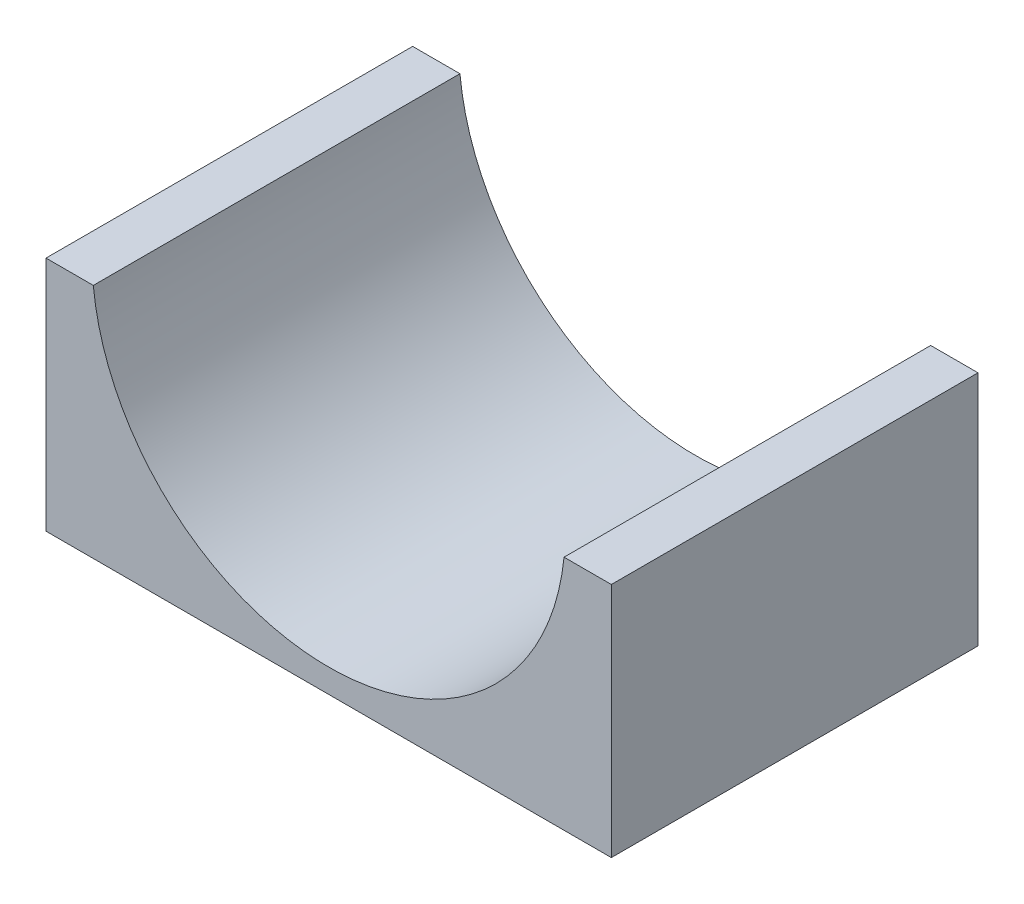
from build123d import *

# Parameters (mm, degrees)
EXTRUDE_1_DEPTH = 15.5


with BuildPart() as part:
    # 草图1 → 凸台-拉伸1 (new body)
    with BuildSketch(Plane.XY):
        with BuildLine():
            Line((10.713527709, 1.733694434), (12.713527709, 1.733694434))
            Line((12.713527709, 1.733694434), (12.713527709, -8.266305566))
            Line((12.713527709, -8.266305566), (-11.186221033, -8.266305566))
            Line((-11.186221033, -8.266305566), (-11.186221033, 1.733694434))
            Line((-11.186221033, 1.733694434), (-9.186221033, 1.733694434))
            ThreePointArc((-9.186221033, 1.733694434), (0.763653338, -7.266305566), (10.713527709, 1.733694434))
        make_face()
    extrude(amount=EXTRUDE_1_DEPTH)


solid = part.part
